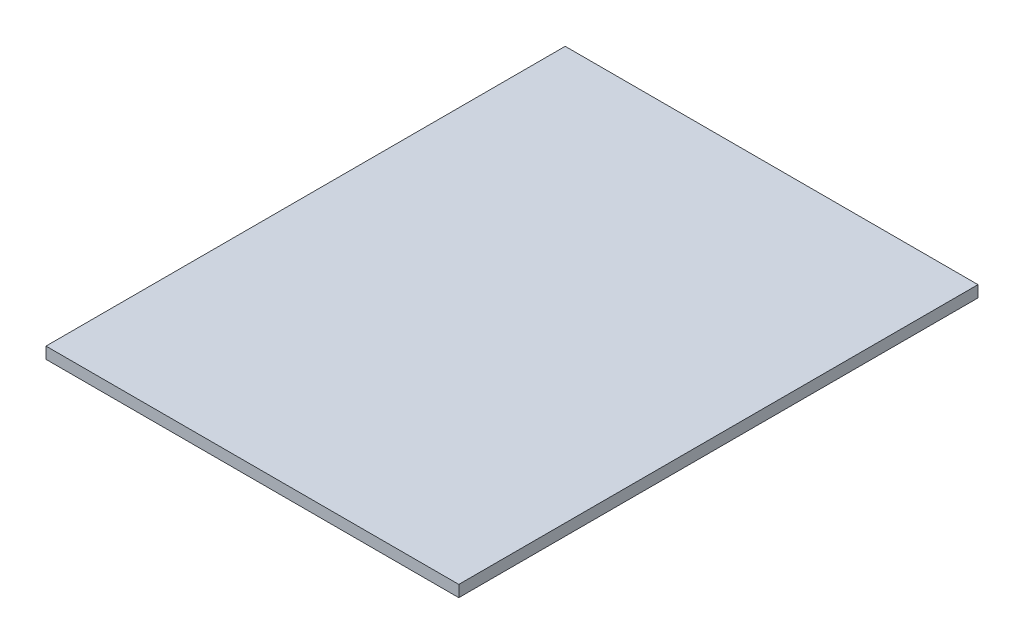
from build123d import *

# Parameters (mm, degrees)
SKETCH1_W           = 609
SKETCH1_H           = 766
BOSS_EXTRUDE1_DEPTH = 17


with BuildPart() as part:
    # Sketch1 → Boss-Extrude1 (new body)
    with BuildSketch(Plane(origin=(0, 0, 0), x_dir=(1, 0, 0), z_dir=(0, 1, 0))):
        with Locations((-0.5, -327.27)):
            Rectangle(SKETCH1_W, SKETCH1_H)
    extrude(amount=BOSS_EXTRUDE1_DEPTH)


solid = part.part
